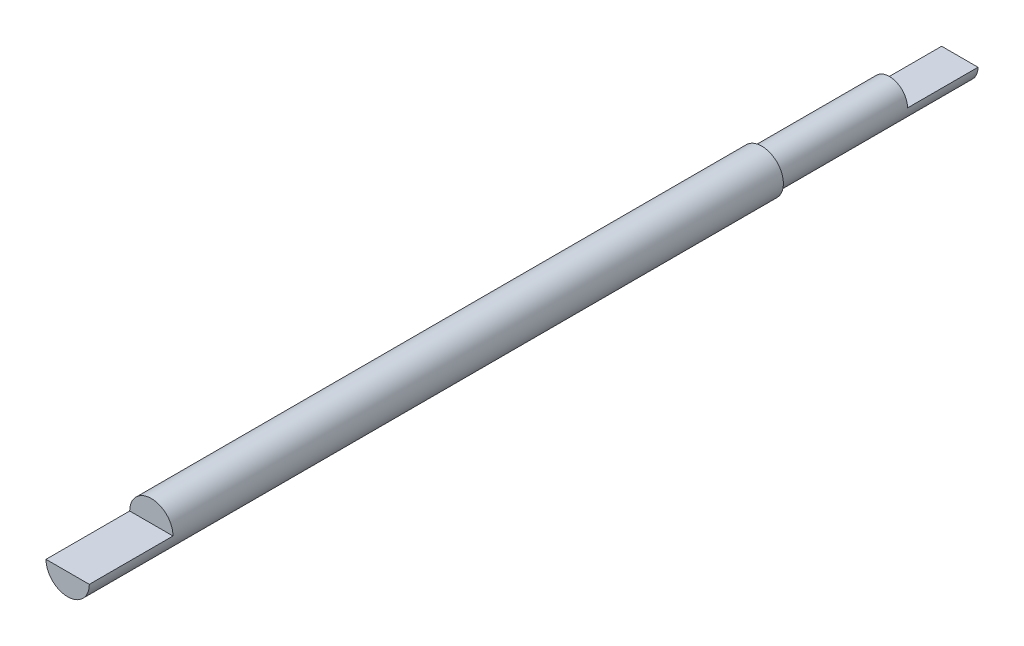
from build123d import *

# Parameters (mm, degrees)
SKETCH1_R           = 4.7625
BOSS_EXTRUDE1_DEPTH = 196.25
CUT_EXTRUDE1_DEPTH  = 18.41
SKETCH3_R           = 4.7625
SKETCH3_R_2         = 4
CUT_EXTRUDE2_DEPTH  = 43.57
CUT_EXTRUDE3_DEPTH  = 15.5


with BuildPart() as part:
    # Sketch1 → Boss-Extrude1 (new body)
    with BuildSketch(Plane.XY):
        Circle(SKETCH1_R)
    extrude(amount=BOSS_EXTRUDE1_DEPTH)

    # Sketch2 → Cut-Extrude1 (cut)
    with BuildSketch(Plane.XY.offset(196.25)):
        Polygon((-36.061047486, 0), (-4.7625, 0), (4.7625, 0), (36.061047486, 0), (36.061047486, 62.597094971), (-36.061047486, 62.597094971), align=None)
    extrude(amount=-CUT_EXTRUDE1_DEPTH, mode=Mode.SUBTRACT)

    # Sketch3 → Cut-Extrude2 (cut)
    with BuildSketch(Plane(origin=(0, 0, 0), x_dir=(-1, 0, 0), z_dir=(0, 0, -1))):
        Circle(SKETCH3_R)
        Circle(SKETCH3_R_2, mode=Mode.SUBTRACT)
    extrude(amount=-CUT_EXTRUDE2_DEPTH, mode=Mode.SUBTRACT)

    # Sketch4 → Cut-Extrude3 (cut)
    with BuildSketch(Plane(origin=(0, 0, 0), x_dir=(-1, 0, 0), z_dir=(0, 0, -1))):
        Polygon((-33.946208913, 0), (-4, 0), (4, 0), (33.946208913, 0), (33.946208913, 59.892417826), (-33.946208913, 59.892417826), align=None)
    extrude(amount=-CUT_EXTRUDE3_DEPTH, mode=Mode.SUBTRACT)


solid = part.part
